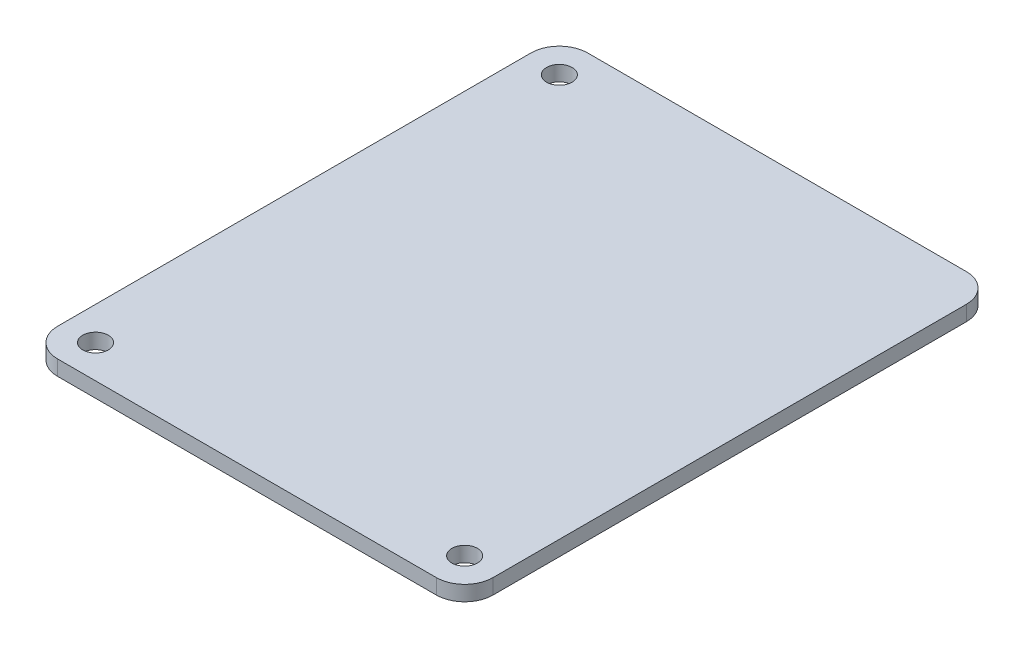
from build123d import *

# Parameters (mm, degrees)
Y_KSEKLIK_EKSTR_ZYON1_DEPTH = 1.6
IZIM2_R                     = 1.35
KES_EKSTR_ZYON1_DEPTH       = 1.6


with BuildPart() as part:
    # Çizim1 → Yükseklik-Ekstrüzyon1 (new body)
    with BuildSketch(Plane(origin=(0, 0, 0), x_dir=(1, 0, 0), z_dir=(0, 1, 0))):
        with BuildLine():
            Line((-20, -28), (20, -28))
            ThreePointArc((20, -28), (22.121320344, -27.121320344), (23, -25))
            Line((23, -25), (23, 25))
            ThreePointArc((23, 25), (22.121320344, 27.121320344), (20, 28))
            Line((20, 28), (-20, 28))
            ThreePointArc((-20, 28), (-22.121320344, 27.121320344), (-23, 25))
            Line((-23, 25), (-23, -25))
            ThreePointArc((-23, -25), (-22.121320344, -27.121320344), (-20, -28))
        make_face()
    extrude(amount=Y_KSEKLIK_EKSTR_ZYON1_DEPTH)

    # Çizim2 → Kes-Ekstrüzyon1 (cut)
    with BuildSketch(Plane(origin=(0, 1.6, 0), x_dir=(1, 0, 0), z_dir=(0, 1, 0))):
        with Locations(Location((-19.5, 24.5, 0), (0, 0, 270))):
            Circle(IZIM2_R)
        with Locations(Location((19.5, -24.5, 0), (0, 0, 270))):
            Circle(IZIM2_R)
        with Locations(Location((-19.5, -24.5, 0), (0, 0, 90))):
            Circle(IZIM2_R)
    extrude(amount=-KES_EKSTR_ZYON1_DEPTH, mode=Mode.SUBTRACT)


solid = part.part
